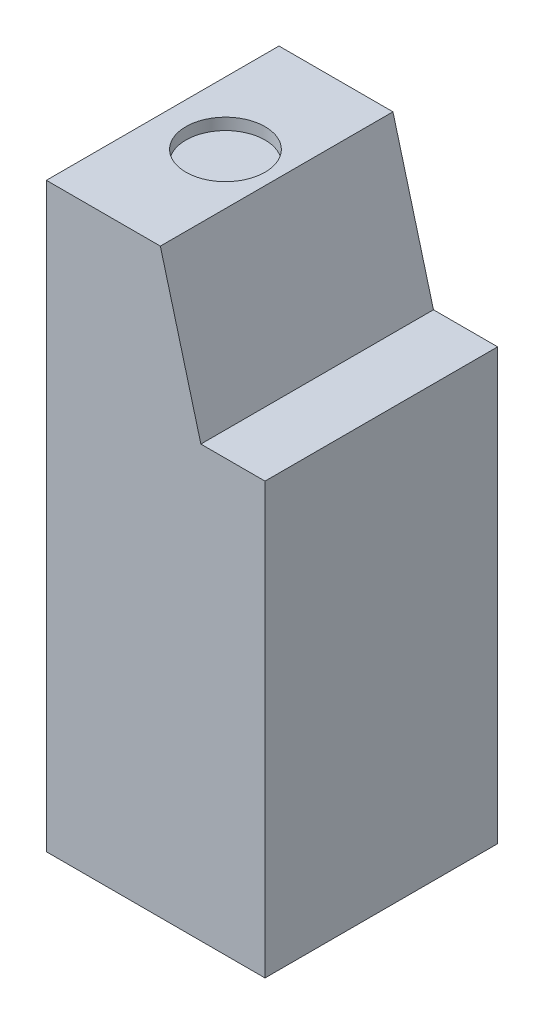
from build123d import *

# Parameters (mm, degrees)
BASE_SKETCH_W          = 9.4
BASE_SKETCH_H          = 18.5
BASE_DEPTH             = 5
BASE_TOP_DEPTH         = 5
MAN_OP_CUTOUT_SKETCH_R = 1.7
MAN_OP_CUTOUT_DEPTH    = 0.5


with BuildPart() as part:
    # Base Sketch → Base (new, symmetric)
    with BuildSketch(Plane.XY):
        with Locations((-4.7, 9.25)):
            Rectangle(BASE_SKETCH_W, BASE_SKETCH_H)
    extrude(amount=BASE_DEPTH, both=True)

    # Base Top Sketch → Base Top (add, symmetric)
    with BuildSketch(Plane.XY):
        Polygon((-2.758330249, 18.5), (-9.4, 18.5), (-9.4, 25), (-4.5, 25), align=None)
    extrude(amount=BASE_TOP_DEPTH, both=True)

    # Man-op cutout sketch → Man-op cutout (cut)
    with BuildSketch(Plane(origin=(0, 25, 0), x_dir=(-1, 0, 0), z_dir=(0, 1, 0))):
        with Locations(Location((6.7, 0, 0), (0, 0, 90))):
            Circle(MAN_OP_CUTOUT_SKETCH_R)
    extrude(amount=-MAN_OP_CUTOUT_DEPTH, mode=Mode.SUBTRACT)


solid = part.part
